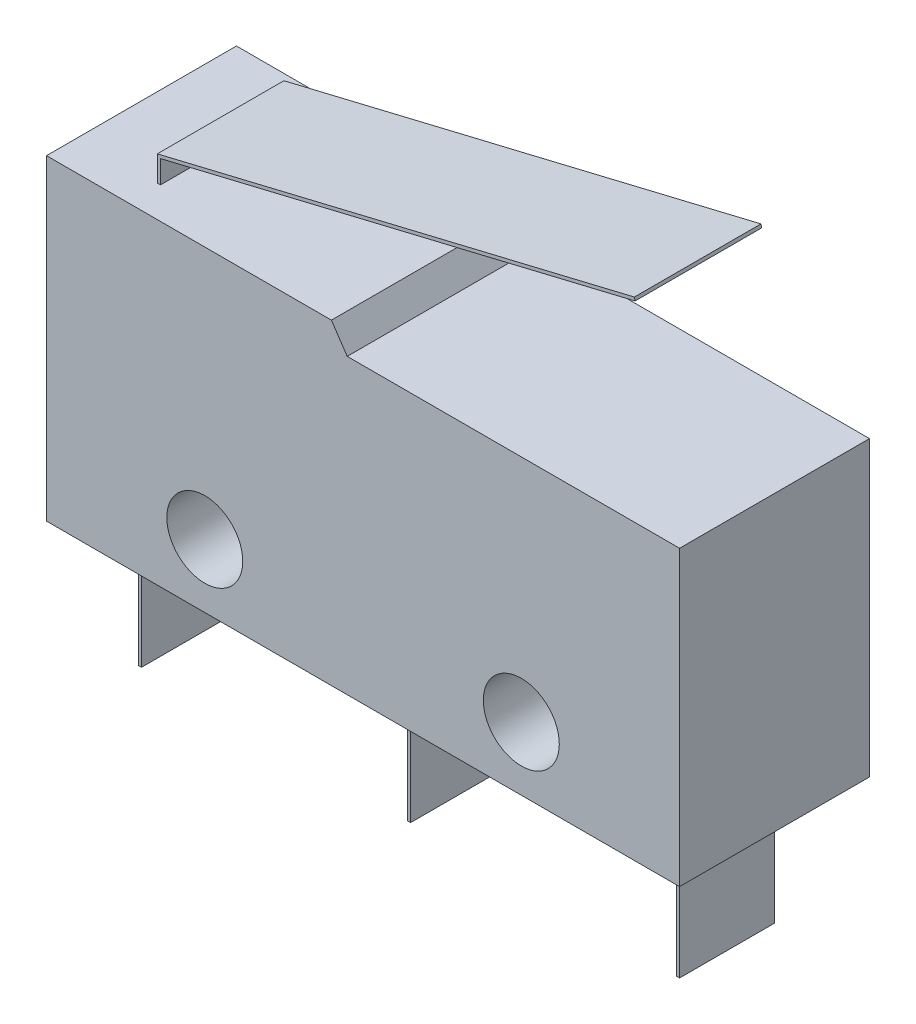
from build123d import *

# Parameters (mm, degrees)
SKETCH1_R           = 1.2
BOSS_EXTRUDE1_DEPTH = 6
EXTRUDE_THIN1_START = -1
EXTRUDE_THIN1_DEPTH = 4
SKETCH3_W           = 0.1
SKETCH3_H           = 3
EXTRUDE_THIN2_DEPTH = 4


with BuildPart() as part:
    # Sketch1 → Boss-Extrude1 (new body)
    with BuildSketch(Plane.XY):
        Polygon((-0.5, 4.258314247), (-1, 5), (-10, 5), (-10, -5), (10, -5), (10, 4.258314247), align=None)
        with Locations((-5, -3)):
            Circle(SKETCH1_R, mode=Mode.SUBTRACT)
        with Locations((5, -3)):
            Circle(SKETCH1_R, mode=Mode.SUBTRACT)
    extrude(amount=BOSS_EXTRUDE1_DEPTH)

    # Sketch2 → Extrude-Thin1 (add)
    with BuildSketch(Plane.XY.offset(6).offset(EXTRUDE_THIN1_START)):
        Polygon((-7.5, 5), (-7.5, 5.8), (7.571733766, 9.41840314), (7.595078303, 9.321166148), (-7.4, 5.721166357), (-7.4, 5), align=None)
    extrude(amount=-EXTRUDE_THIN1_DEPTH)

    # Sketch3 → Extrude-Thin2 (add)
    with BuildSketch(Plane.XZ.offset(5)):
        with Locations((-8.55, 3)):
            Rectangle(SKETCH3_W, SKETCH3_H)
        with Locations((8.45, 3)):
            Rectangle(SKETCH3_W, SKETCH3_H)
        with Locations((-0.05, 3)):
            Rectangle(SKETCH3_W, SKETCH3_H)
    extrude(amount=EXTRUDE_THIN2_DEPTH)


solid = part.part
